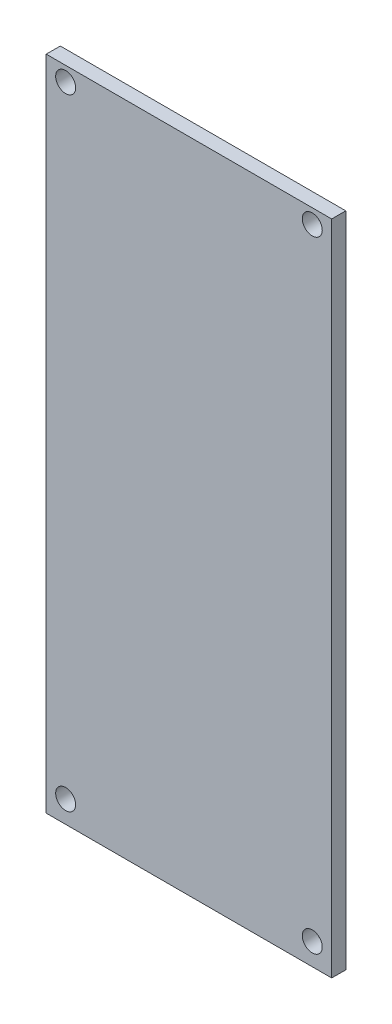
from build123d import *

# Parameters (mm, degrees)
SKETCH1_W           = 30.4
SKETCH1_H           = 70
SKETCH1_R           = 1.065
BOSS_EXTRUDE1_DEPTH = 1.5


with BuildPart() as part:
    # Sketch1 → Boss-Extrude1 (new body)
    with BuildSketch(Plane.XY):
        with Locations((0, -0.401900364)):
            Rectangle(SKETCH1_W, SKETCH1_H)
        with Locations((13.13, 33.06)):
            Circle(SKETCH1_R, mode=Mode.SUBTRACT)
        with Locations(Location((-13.13, 33.06, 0), (0, 0, 180))):
            Circle(SKETCH1_R, mode=Mode.SUBTRACT)
        with Locations((-13.13, -33.06)):
            Circle(SKETCH1_R, mode=Mode.SUBTRACT)
        with Locations(Location((13.13, -33.06, 0), (0, 0, 180))):
            Circle(SKETCH1_R, mode=Mode.SUBTRACT)
    extrude(amount=BOSS_EXTRUDE1_DEPTH)


solid = part.part
